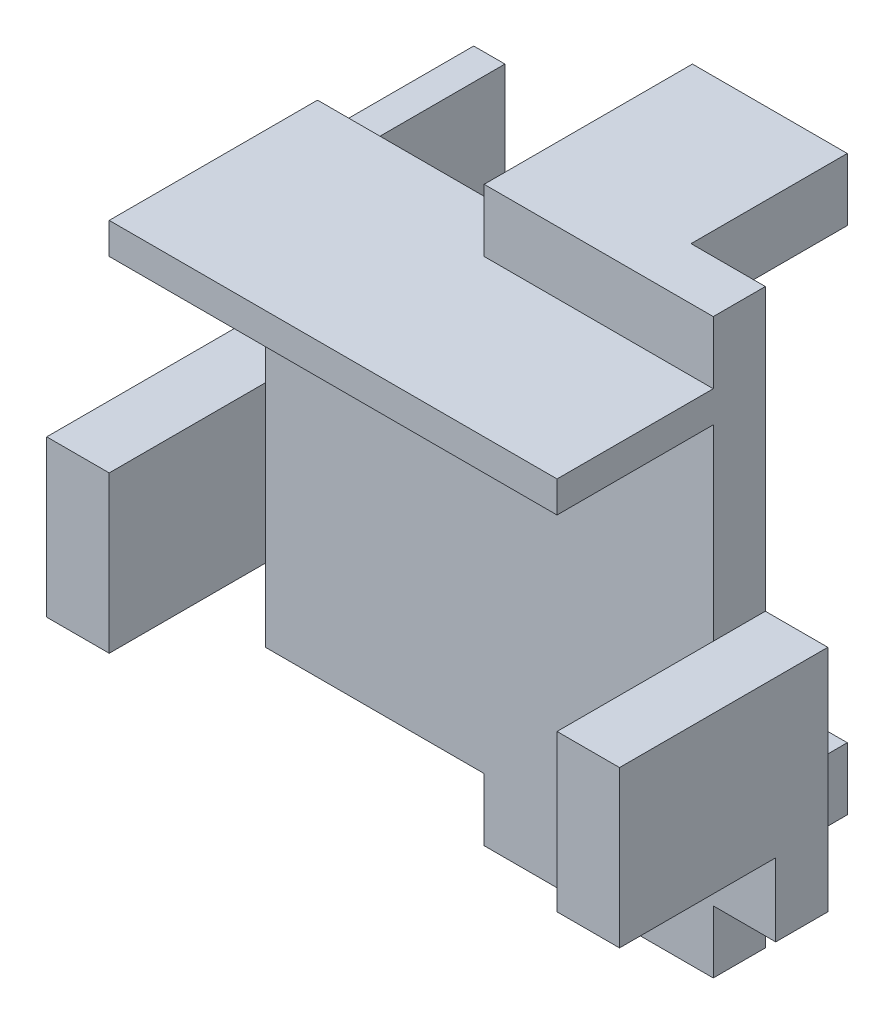
from build123d import *

# Parameters (mm, degrees)
SKETCH_1_W        = 6
SKETCH_1_H        = 15
EXTRUDE_3_DEPTH   = 15
SKETCH_1_7_W      = 6
SKETCH_1_7_H      = 15
EXTRUDE_3_2_DEPTH = 15
EXTRUDE_4_DEPTH   = 15
EXTRUDE_5_DEPTH   = 5
SKETCH_1_13_W     = 3
SKETCH_1_13_H     = 40
EXTRUDE_10_DEPTH  = 20
SKETCH_3_W        = 14.869090603
SKETCH_3_H        = 6
EXTRUDE_15_DEPTH  = 15


with BuildPart() as part:
    # 草图1 → Extrude 3 (new body)
    with BuildSketch(Plane.XY):
        with Locations((-25.796959303, 23.532605762)):
            Rectangle(SKETCH_1_W, SKETCH_1_H)
    extrude(amount=EXTRUDE_3_DEPTH)



with BuildPart() as body_2:
    # 草图1<7> → Extrude 3 2 (new body)
    with BuildSketch(Plane.XY):
        with Locations((-74.796959303, 23.532605762)):
            Rectangle(SKETCH_1_7_W, SKETCH_1_7_H)
    extrude(amount=EXTRUDE_3_2_DEPTH)


with BuildPart() as body_3:
    # 草图1<8> → 凸台-拉伸4 (new body)
    with BuildSketch(Plane.XY):
        Polygon((-71.796959303, 49.032605762), (-68.796959303, 49.032605762), (-50.796959303, 49.032605762), (-28.796959303, 49.032605762), (-28.796959303, 52.032605762), (-35.796959303, 52.032605762), (-50.796959303, 52.032605762), (-71.796959303, 52.032605762), align=None)
    extrude(amount=EXTRUDE_4_DEPTH)


with BuildPart() as part_1:
    add(part.part)

    add(body_2.part)  # 凸台-拉伸5 merges body 2

    add(body_3.part)  # 凸台-拉伸5 merges body 3
    # 草图1<11> → 凸台-拉伸5 (add)
    with BuildSketch(Plane.XY):
        Polygon((-50.796959303, 3.032605762), (-28.796959303, 3.032605762), (-28.796959303, 9.032605762), (-22.796959303, 9.032605762), (-22.796959303, 31.032605762), (-28.796959303, 31.032605762), (-28.796959303, 58.032605762), (-50.796959303, 58.032605762), (-50.796959303, 52.032605762), (-71.796959303, 52.032605762), (-71.796959303, 31.032605762), (-77.796959303, 31.032605762), (-77.796959303, 16.032605762), (-71.796959303, 16.032605762), (-71.796959303, 9.032605762), (-50.796959303, 9.032605762), align=None)
    extrude(amount=-EXTRUDE_5_DEPTH)

    # 草图1<13> → 凸台-拉伸10 (add)
    with BuildSketch(Plane.XY):
        with Locations((-70.296959303, 29.032605762)):
            Rectangle(SKETCH_1_13_W, SKETCH_1_13_H)
    extrude(amount=-EXTRUDE_10_DEPTH)

    # 草图3 → 凸台-拉伸15 (add)
    with BuildSketch(Plane(origin=(0, 0, -5), x_dir=(-1, 0, 0), z_dir=(0, 0, -1))):
        with Locations((43.362414001, 55.032605762)):
            Rectangle(SKETCH_3_W, SKETCH_3_H)
        with Locations((43.362414001, 6.032605762)):
            Rectangle(SKETCH_3_W, SKETCH_3_H)
    extrude(amount=EXTRUDE_15_DEPTH)


solid = part_1.part
